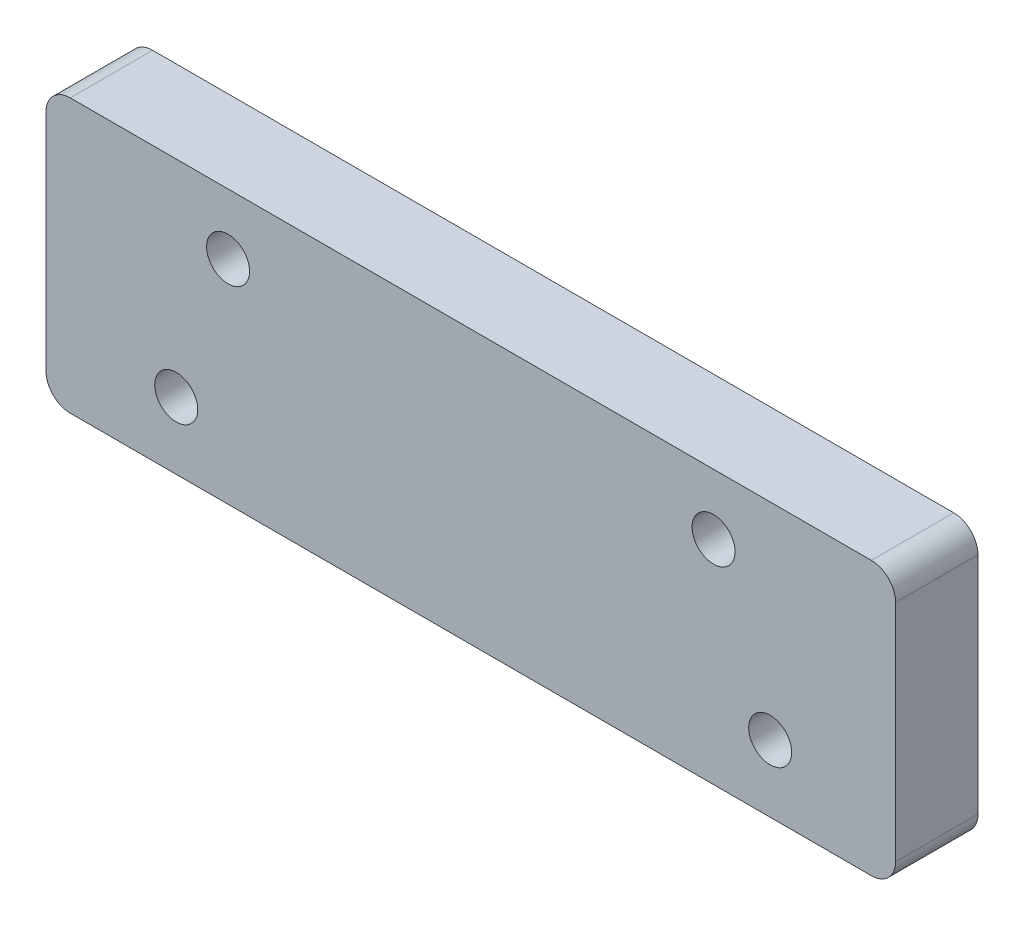
from build123d import *

# Parameters (mm, degrees)
SKETCH1_W                      = 88.9
SKETCH1_H                      = 15.875
BOSS_EXTRUDE1_DEPTH            = 7.62
CBORE_FOR_M4_SHCS1_D           = 4.5
CBORE_FOR_M4_SHCS1_CBORE_D     = 8
CBORE_FOR_M4_SHCS1_CBORE_DEPTH = 4
BOSS_EXTRUDE2_START            = 1
SKETCH4_W                      = 88.9
SKETCH4_H                      = 15.875
SKETCH4_R                      = 4
BOSS_EXTRUDE2_DEPTH            = 1
SKETCH5_W                      = 88.9
SKETCH5_H                      = 12.7
SKETCH5_R                      = 2
BOSS_EXTRUDE3_DEPTH            = 8.62
M4_CLEARANCE_HOLE1_D           = 4.5
FILLET1_R                      = 2.54


with BuildPart() as part:
    # Sketch1 → Boss-Extrude1 (new body)
    with BuildSketch(Plane.XY):
        with Locations((61.9, 7.9375)):
            Rectangle(SKETCH1_W, SKETCH1_H)
    extrude(amount=-BOSS_EXTRUDE1_DEPTH)

    # CBORE for M4 SHCS1 (through all)
    with Locations(Plane(origin=(0, 0, -7.62), x_dir=(-1, 0, 0), z_dir=(0, 0, -1))):
        with Locations((-93.225, 7), (-31.075, 7)):
            CounterBoreHole(CBORE_FOR_M4_SHCS1_D / 2, CBORE_FOR_M4_SHCS1_CBORE_D / 2, CBORE_FOR_M4_SHCS1_CBORE_DEPTH)

    # Sketch4 → Boss-Extrude2 (add)
    with BuildSketch(Plane(origin=(0, 0, -7.62), x_dir=(-1, 0, 0), z_dir=(0, 0, -1)).offset(BOSS_EXTRUDE2_START)):
        with Locations((-61.9, 7.9375)):
            Rectangle(SKETCH4_W, SKETCH4_H)
        with Locations((-93.225, 7)):
            Circle(SKETCH4_R, mode=Mode.SUBTRACT)
        with Locations((-31.075, 7)):
            Circle(SKETCH4_R, mode=Mode.SUBTRACT)
    extrude(amount=-BOSS_EXTRUDE2_DEPTH)

    # Sketch5 → Boss-Extrude3 (add)
    # profile 1 of 3: a face of its own
    with BuildSketch(Plane.XY):
        with Locations((61.9, 22.225)):
            Rectangle(SKETCH5_W, SKETCH5_H)
        with Locations((36.5, 22.225)):
            Circle(SKETCH5_R, mode=Mode.SUBTRACT)
        with Locations((87.3, 22.225)):
            Circle(SKETCH5_R, mode=Mode.SUBTRACT)
    # profile 2 of 3: a face of its own
    with BuildSketch(Plane.XY):
        with Locations((36.5, 22.225)):
            Circle(SKETCH5_R)
    # profile 3 of 3: a face of its own
    with BuildSketch(Plane.XY):
        with Locations((87.3, 22.225)):
            Circle(SKETCH5_R)
    extrude(amount=-BOSS_EXTRUDE3_DEPTH)

    # M4 Clearance Hole1 (through all)
    with Locations(Plane.XY):
        with Locations((36.5, 22.225), (87.3, 22.225)):
            Hole(M4_CLEARANCE_HOLE1_D / 2)

    # Fillet1
    fillet1_edges = [part.edges().sort_by_distance(p)[0] for p in [
        (17.45, 28.575, -4.31),
        (106.35, 28.575, -4.31),
        (106.35, 0, -4.31),
        (17.45, 0, -4.31),
    ]]
    fillet(fillet1_edges, radius=FILLET1_R)


solid = part.part
